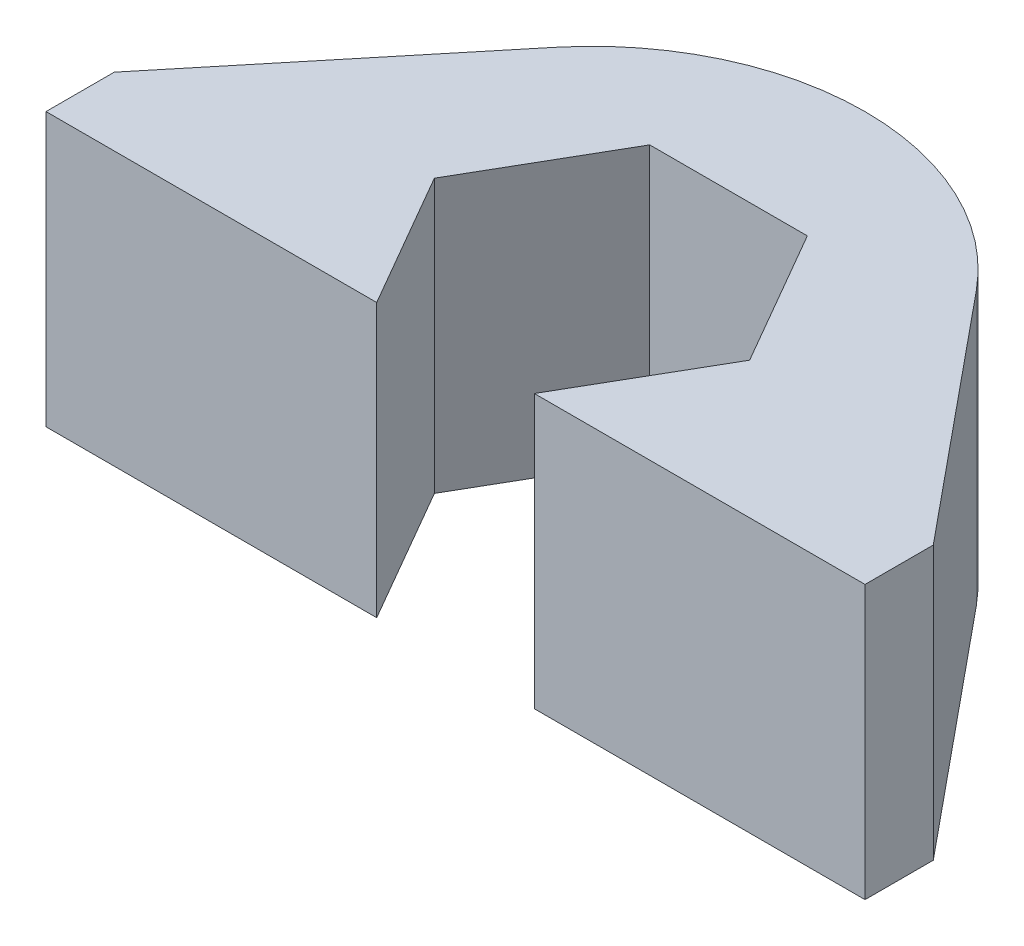
from build123d import *

# Parameters (mm, degrees)
BOSS_EXTRUDE1_DEPTH = 12.7


with BuildPart() as part:
    # Sketch1 → Boss-Extrude1 (new body)
    with BuildSketch(Plane(origin=(0, 0, 0), x_dir=(1, 0, 0), z_dir=(0, 1, 0))):
        with BuildLine():
            Line((3.666174209, -6.35), (19.05, -6.35))
            Line((19.05, -6.35), (19.05, -3.175))
            Line((19.05, -3.175), (9.810775982, 8.064655891))
            ThreePointArc((9.810775982, 8.064655891), (0, 12.7), (-9.810775982, 8.064655891))
            Line((-9.810775982, 8.064655891), (-19.05, -3.175))
            Line((-19.05, -3.175), (-19.05, -6.35))
            Line((-19.05, -6.35), (-3.666174209, -6.35))
            Line((-3.666174209, -6.35), (-7.332348419, 0))
            Line((-7.332348419, 0), (-3.666174209, 6.35))
            Line((-3.666174209, 6.35), (3.666174209, 6.35))
            Line((3.666174209, 6.35), (7.332348419, 0))
            Line((7.332348419, 0), (3.666174209, -6.35))
        make_face()
    extrude(amount=BOSS_EXTRUDE1_DEPTH)


solid = part.part
